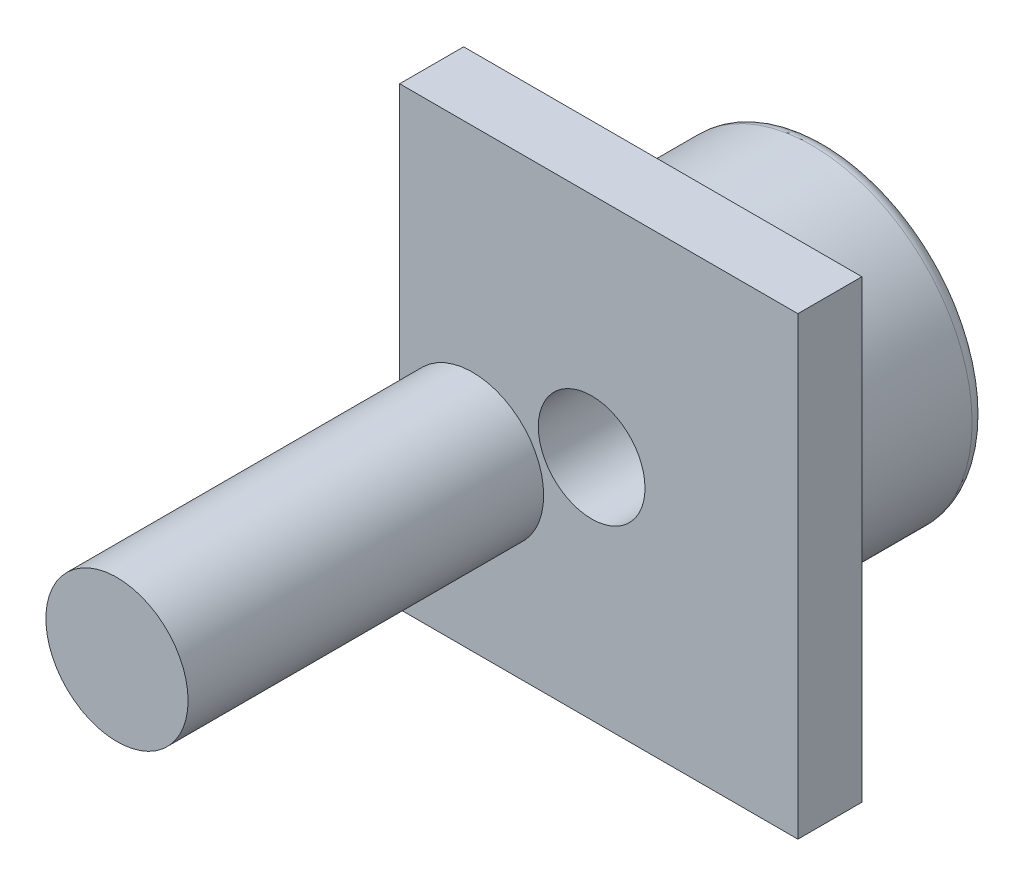
from build123d import *

# Parameters (mm, degrees)
SKETCH_1_R          = 4.5
EXTRUDE_1_DEPTH     = 4.8
SKETCH_2_W          = 11.2
SKETCH_2_H          = 13.8
EXTRUDE_2_DEPTH     = 1.8
SKETCH_4_R          = 2
EXTRUDE_5_DEPTH     = 10
SKETCH_6_W          = 11.2
SKETCH_6_H          = 1
CUT_EXTRUDE_2_DEPTH = 2
FILLET_1_R          = 0.4
SKETCH_3_R          = 3
CUT_EXTRUDE_1_DEPTH = 4
SKETCH_7_R          = 1.5
CUT_EXTRUDE_3_DEPTH = 16.276125163


with BuildPart() as part:
    # Эскиз1 → Бобышка-Вытянуть1 (new body)
    with BuildSketch(Plane.XY):
        Circle(SKETCH_1_R)
    extrude(amount=EXTRUDE_1_DEPTH)

    # Эскиз2 → Бобышка-Вытянуть2 (add)
    with BuildSketch(Plane.XY.offset(4.8)):
        with Locations((0.2, 0.5)):
            Rectangle(SKETCH_2_W, SKETCH_2_H)
    extrude(amount=EXTRUDE_2_DEPTH)

    # Эскиз4 → Бобышка-Вытянуть5 (add)
    with BuildSketch(Plane.XY.offset(6.6)):
        with Locations((-3.35, -1.6)):
            Circle(SKETCH_4_R)
    extrude(amount=EXTRUDE_5_DEPTH)

    # Эскиз6 → Вырез-Вытянуть2 (cut)
    with BuildSketch(Plane.XY.offset(6.6)):
        with Locations((0.2, 6.9)):
            Rectangle(SKETCH_6_W, SKETCH_6_H)
    extrude(amount=-CUT_EXTRUDE_2_DEPTH, mode=Mode.SUBTRACT)

    # Скругление1
    fillet_1_edges = [part.edges().sort_by_distance(p)[0] for p in [
        (-4.5, 0, 0),
    ]]
    fillet(fillet_1_edges, radius=FILLET_1_R)

    # Эскиз3 → Вырез-Вытянуть1 (cut)
    with BuildSketch(Plane(origin=(0, 0, 0), x_dir=(-1, 0, 0), z_dir=(0, 0, -1))):
        Circle(SKETCH_3_R)
    extrude(amount=-CUT_EXTRUDE_1_DEPTH, mode=Mode.SUBTRACT)

    # Эскиз7 → Вырез-Вытянуть3 (cut, through all)
    with BuildSketch(Plane(origin=(0, 0, 4), x_dir=(-1, 0, 0), z_dir=(0, 0, -1))):
        Circle(SKETCH_7_R)
    extrude(amount=-CUT_EXTRUDE_3_DEPTH, mode=Mode.SUBTRACT)


solid = part.part
